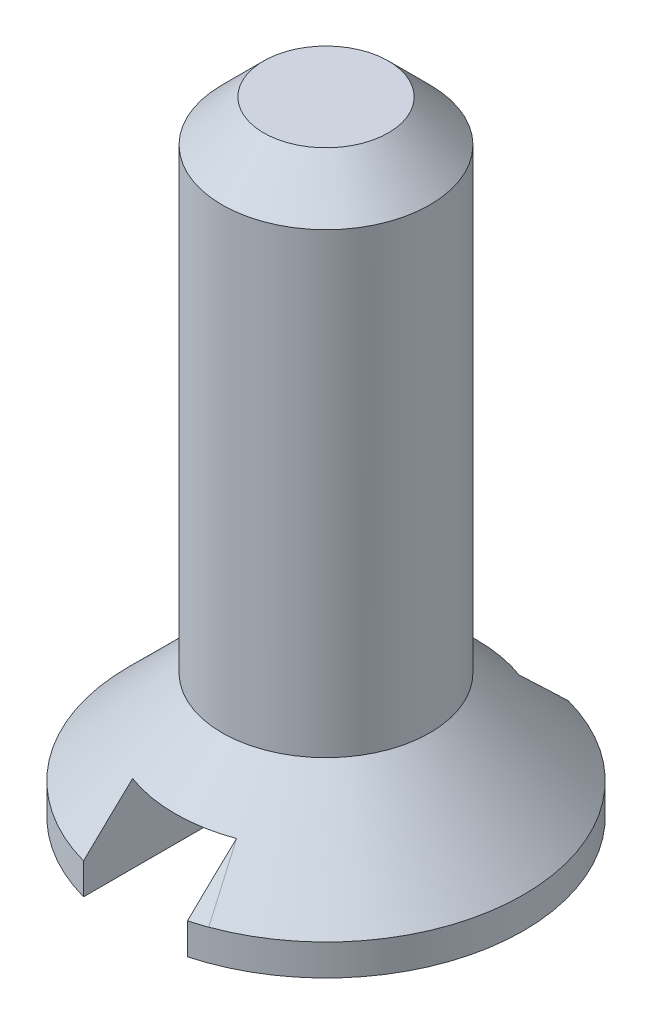
from build123d import *

# Parameters (mm, degrees)
SKETCH_1_W          = 1
SKETCH_1_H          = 4.8
SKETCH_2_W          = 1
SKETCH_2_H          = 0.75
CUT_EXTRUDE_1_DEPTH = 10
CHAMFER_1_SIZE      = 0.4


with BuildPart() as part:
    # Эскиз1 → Повернуть1 (revolve)
    with BuildSketch(Plane.XY):
        with Locations((-0.5, 3.6)):
            Rectangle(SKETCH_1_W, SKETCH_1_H)
        Polygon((-1.9, 0), (0, 0), (0, 1.2), (-1, 1.2), (-1.9, 0.3), align=None)
    revolve(axis=Axis((0, 6, 0), (0, -1, 0)))

    # Эскиз2 → Вырез-Вытянуть1 (cut, symmetric)
    with BuildSketch(Plane.XY):
        with Locations((0, 0.375)):
            Rectangle(SKETCH_2_W, SKETCH_2_H)
    extrude(amount=CUT_EXTRUDE_1_DEPTH, both=True, mode=Mode.SUBTRACT)

    # Фаска1
    chamfer_1_edges = [part.edges().sort_by_distance(p)[0] for p in [
        (1, 6, 0),
    ]]
    chamfer(chamfer_1_edges, length=CHAMFER_1_SIZE)


solid = part.part
